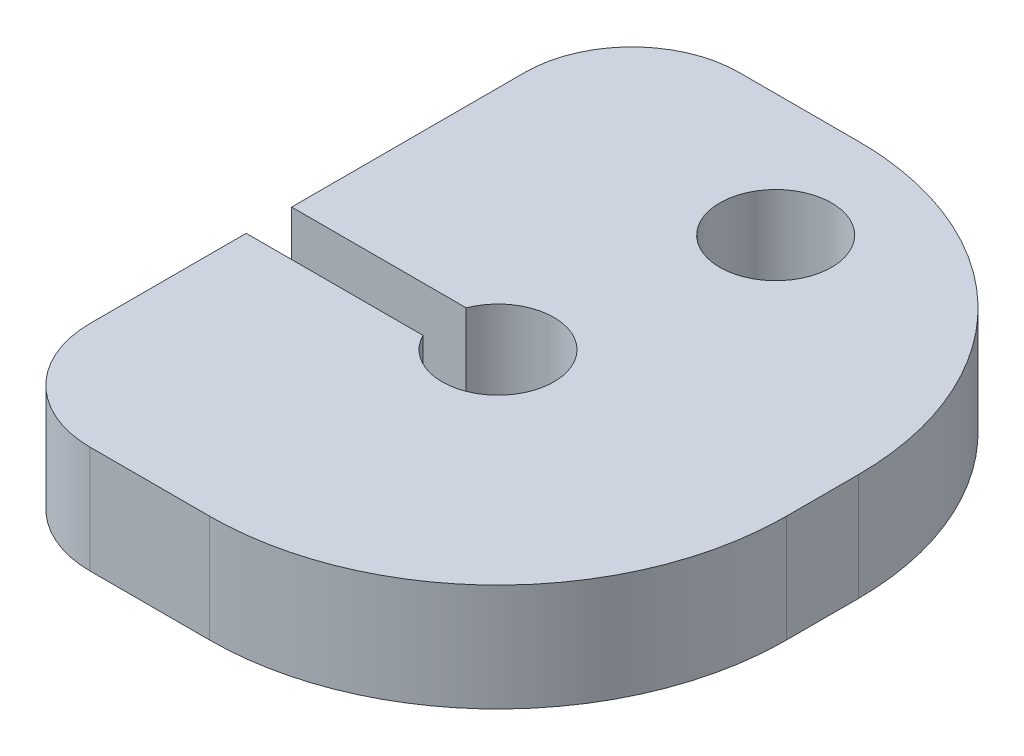
from build123d import *

# Parameters (mm, degrees)
SKETCH1_W           = 50.8
SKETCH1_H           = 22.86
BOSS_EXTRUDE1_DEPTH = 3.175
FILLET1_R           = 10.16
SKETCH3_R           = 1.9685
CUT_EXTRUDE1_DEPTH  = 29.033649869
FILLET3_R           = 10.16
SCALE1_SCALE_X      = 0.84
SCALE1_SCALE_Y      = 1
SCALE1_SCALE_Z      = 0.84
SKETCH4_W           = 27.432
SKETCH4_H           = 19.2024
CUT_EXTRUDE2_DEPTH  = 24.662372423
FILLET4_R           = 3.175
SKETCH5_W           = 6.941589501
SKETCH5_H           = 1.34494551
CUT_EXTRUDE3_DEPTH  = 24.567033234


with BuildPart() as part:
    # Sketch1 → Boss-Extrude1 (new body)
    with BuildSketch(Plane(origin=(0, 0, 0), x_dir=(1, 0, 0), z_dir=(0, 1, 0))):
        Rectangle(SKETCH1_W, SKETCH1_H)
    extrude(amount=BOSS_EXTRUDE1_DEPTH)

    # Fillet1
    fillet1_edges = [part.edges().sort_by_distance(p)[0] for p in [
        (25.4, 1.5875, 11.43),
        (-25.4, 1.5875, 11.43),
    ]]
    fillet(fillet1_edges, radius=FILLET1_R)

    # Sketch3 → Cut-Extrude1 (cut, through all)
    with BuildSketch(Plane(origin=(0, 3.175, 0), x_dir=(1, 0, 0), z_dir=(0, 1, 0))):
        with Locations(Location((15.24, -1.27, 0), (0, 0, 270))):
            Circle(SKETCH3_R)
        with Locations(Location((16.637, 7.112, 0), (0, 0, 270))):
            Circle(SKETCH3_R)
        with Locations(Location((-3.81, -1.27, 0), (0, 0, 270))):
            Circle(SKETCH3_R)
    extrude(amount=-CUT_EXTRUDE1_DEPTH, mode=Mode.SUBTRACT)

    # Fillet3
    fillet3_edges = [part.edges().sort_by_distance(p)[0] for p in [
        (-25.4, 1.5875, -11.43),
        (25.4, 1.5875, -11.43),
    ]]
    fillet(fillet3_edges, radius=FILLET3_R)


with BuildPart() as part_1:
    # Scale1: scaled about (-0.329754669, 1.5875, 0.053715693)
    add(part.part.scale((SCALE1_SCALE_X, SCALE1_SCALE_Y, SCALE1_SCALE_Z), about=(-0.329754669, 1.5875, 0.053715693)))

    # Sketch4 → Cut-Extrude2 (cut, through all)
    with BuildSketch(Plane(origin=(0, 0, 0), x_dir=(-1, 0, 0), z_dir=(0, -1, 0))):
        with Locations((7.672760747, -0.008594511)):
            Rectangle(SKETCH4_W, SKETCH4_H)
    extrude(amount=-CUT_EXTRUDE2_DEPTH, mode=Mode.SUBTRACT)

    # Fillet4
    fillet4_edges = [part_1.edges().sort_by_distance(p)[0] for p in [
        (6.043239253, 1.5875, 9.609794511),
        (6.043239253, 1.5875, -9.592605489),
    ]]
    fillet(fillet4_edges, radius=FILLET4_R)

    # Sketch5 → Cut-Extrude3 (cut, through all)
    with BuildSketch(Plane.XZ):
        with Locations((9.514034004, 1.147870629)):
            Rectangle(SKETCH5_W, SKETCH5_H)
    extrude(amount=-CUT_EXTRUDE3_DEPTH, mode=Mode.SUBTRACT)


solid = part_1.part
